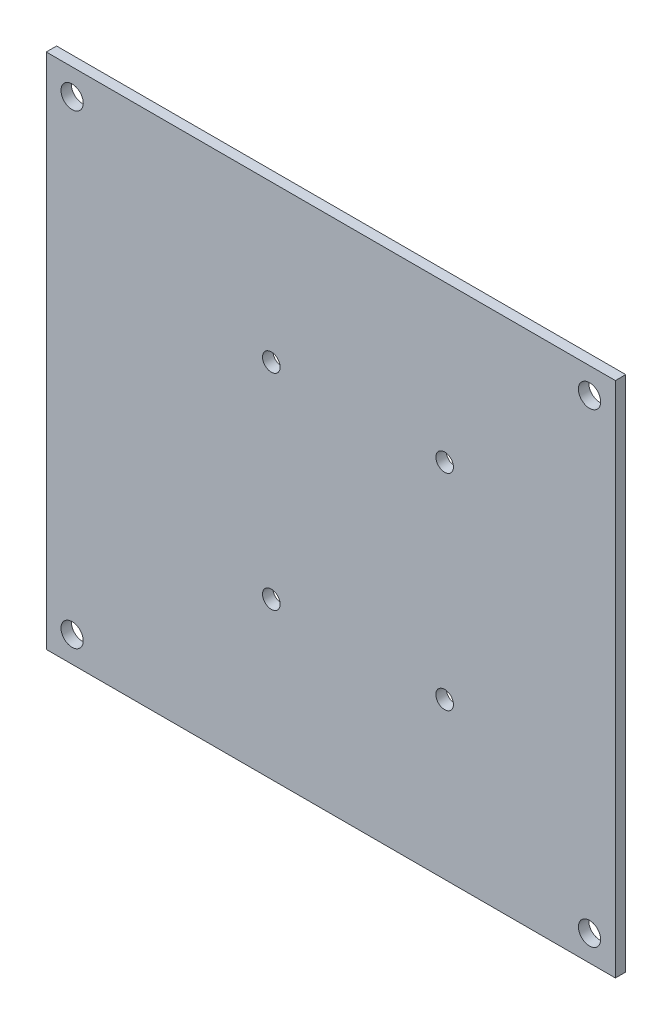
from build123d import *

# Parameters (mm, degrees)
SKETCH_1_W          = 110
SKETCH_1_H          = 100
SKETCH_1_R          = 2.15
EXTRUDE_1_DEPTH     = 1
SKETCH_2_R          = 1.7
CUT_EXTRUDE_1_DEPTH = 15


with BuildPart() as part:
    # Эскиз1 → Бобышка-Вытянуть1 (new, symmetric)
    with BuildSketch(Plane.XY):
        Rectangle(SKETCH_1_W, SKETCH_1_H)
        with Locations((-50, 45)):
            Circle(SKETCH_1_R, mode=Mode.SUBTRACT)
        with Locations(Location((50, 45, 0), (0, 0, 180))):
            Circle(SKETCH_1_R, mode=Mode.SUBTRACT)
        with Locations((50, -45)):
            Circle(SKETCH_1_R, mode=Mode.SUBTRACT)
        with Locations(Location((-50, -45, 0), (0, 0, 180))):
            Circle(SKETCH_1_R, mode=Mode.SUBTRACT)
    extrude(amount=EXTRUDE_1_DEPTH, both=True)

    # Эскиз2 → Вырез-Вытянуть1 (cut)
    with BuildSketch(Plane.XY.offset(1)):
        with Locations((22, 19.85)):
            Circle(SKETCH_2_R)
        with Locations((-11.5, 19.85)):
            Circle(SKETCH_2_R)
        with Locations((22, -19.885932887)):
            Circle(SKETCH_2_R)
        with Locations((-11.5, -19.85)):
            Circle(SKETCH_2_R)
    extrude(amount=-CUT_EXTRUDE_1_DEPTH, mode=Mode.SUBTRACT)


solid = part.part
